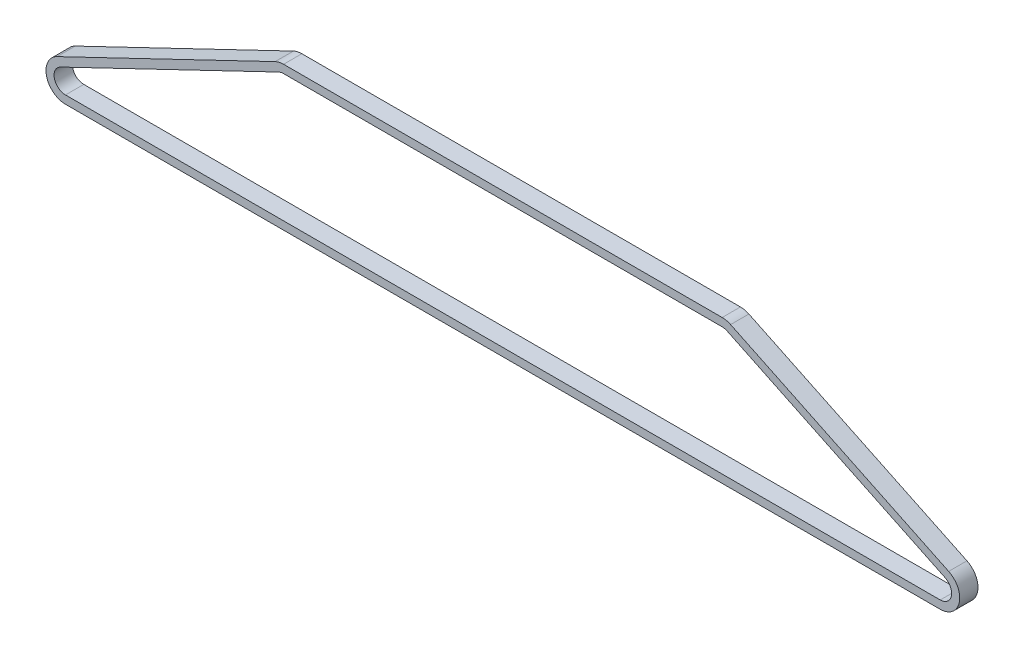
from build123d import *

# Parameters (mm, degrees)
BOSS_EXTRUDE1_DEPTH = 3


with BuildPart() as part:
    # Sketch1 → Boss-Extrude1 (new body)
    with BuildSketch(Plane.XY):
        with BuildLine():
            Line((35.8, -20.38673005), (-107.8, -20.38673005))
            ThreePointArc((-107.8, -20.38673005), (-110.920202034, -17.89689853), (-109.184918209, -14.301942094))
            Line((-109.184918209, -14.301942094), (-73.384918209, 2.884787957))
            ThreePointArc((-73.384918209, 2.884787957), (-72.710168479, 3.120202034), (-72, 3.2))
            Line((-72, 3.2), (0, 3.2))
            ThreePointArc((0, 3.2), (0.710168479, 3.120202034), (1.384918209, 2.884787957))
            Line((1.384918209, 2.884787957), (37.184918209, -14.301942094))
            ThreePointArc((37.184918209, -14.301942094), (38.920202034, -17.89689853), (35.8, -20.38673005))
        make_face()
        with BuildLine():
            ThreePointArc((0.810177152, 1.687600955), (0.41544856, 1.82531819), (0, 1.872))
            Line((0, 1.872), (-72, 1.872))
            ThreePointArc((-72, 1.872), (-72.41544856, 1.82531819), (-72.810177152, 1.687600955))
            Line((-72.810177152, 1.687600955), (-108.610177152, -15.499129096))
            ThreePointArc((-108.610177152, -15.499129096), (-109.62531819, -17.602178611), (-107.8, -19.05873005))
            Line((-107.8, -19.05873005), (35.8, -19.05873005))
            ThreePointArc((35.8, -19.05873005), (37.62531819, -17.602178611), (36.610177152, -15.499129096))
            Line((36.610177152, -15.499129096), (0.810177152, 1.687600955))
        make_face(mode=Mode.SUBTRACT)
    extrude(amount=BOSS_EXTRUDE1_DEPTH)


solid = part.part
